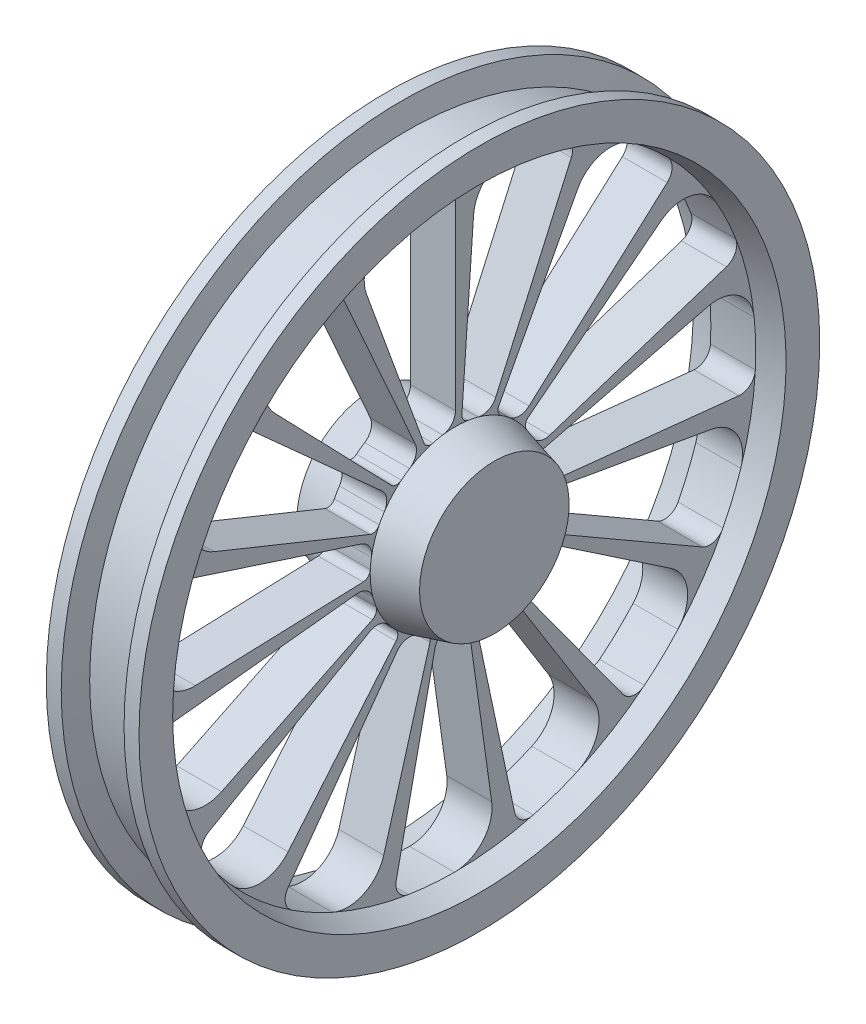
from build123d import *

# Parameters (mm, degrees)
ENL_V_MAT_EXTRU_1_DEPTH      = 654.141638544
R_P_TITION_CIRCULAIRE1_COUNT = 15


with BuildPart() as part:
    # Esquisse1 → Révolution1 (revolve)
    with BuildSketch(Plane.XY, mode=Mode.PRIVATE) as r_volution1_sk:
        Polygon((-82, 0), (-82, 100), (-30, 113.933358006), (-30, 401.425625842), (-62, 410), (-62, 455), (-42, 455), (-33.961524227, 425), (33.961524227, 425), (42, 455), (62, 455), (62, 410), (30, 401.425625842), (30, 113.933358006), (82, 100), (82, 0), align=None)
    revolve(r_volution1_sk.sketch.rotate(Axis((-82, 0, 0), (1, 0, 0)), 90), axis=Axis((-82, 0, 0), (1, 0, 0)))

    # Esquisse2 → Enlèv. mat.-Extru.1 (cut, through all)
    with BuildSketch(Plane.ZY.offset(30)):
        with BuildLine():
            Line((0, 132.431659307), (0, 380.900916314))
            ThreePointArc((0, 380.900916314), (6.233626925, 395.409085474), (21.048697237, 400.873403243))
            ThreePointArc((21.048697237, 400.873403243), (51.79221228, 398.070470934), (82.22942072, 392.913292535))
            ThreePointArc((82.22942072, 392.913292535), (115.680172839, 368.282570612), (118.971877939, 326.872548187))
            Line((118.971877939, 326.872548187), (42.249494034, 116.079530842))
            ThreePointArc((42.249494034, 116.079530842), (37.441245649, 110.614686646), (30.201742548, 109.857475001))
            ThreePointArc((30.201742548, 109.857475001), (23.649020488, 111.451935365), (17.013440072, 112.655904965))
            ThreePointArc((17.013440072, 112.655904965), (4.83868082, 119.388101483), (0, 132.431659307))
        make_face()
    enl_v_mat_extru_1 = extrude(amount=-ENL_V_MAT_EXTRU_1_DEPTH, mode=Mode.SUBTRACT)

    # Répétition circulaire1: Enlèv. mat.-Extru.1 ×15 about axis
    r_p_tition_circulaire1_axis = Axis((0, 0, 0), (1, 0, 0))
    for i in range(1, R_P_TITION_CIRCULAIRE1_COUNT):
        add(enl_v_mat_extru_1.rotate(r_p_tition_circulaire1_axis, i * 360 / R_P_TITION_CIRCULAIRE1_COUNT), mode=Mode.SUBTRACT)


solid = part.part
